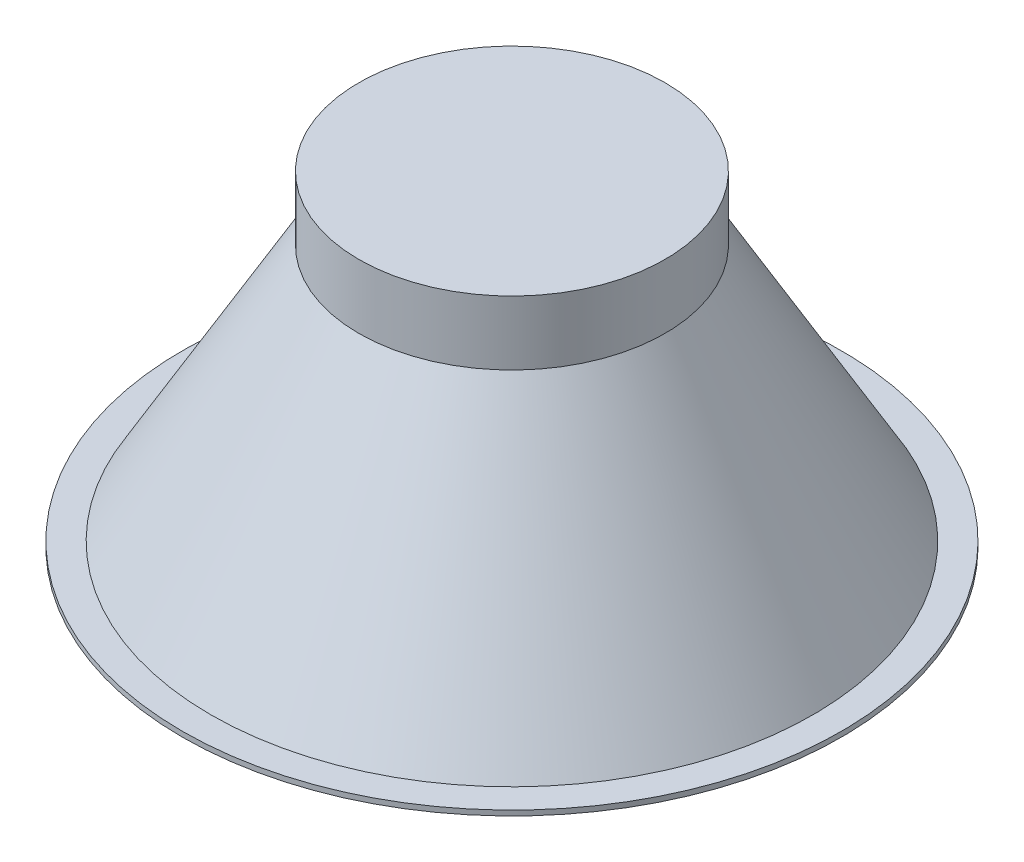
from build123d import *

# Parameters (mm, degrees)
SKETCH1_R           = 128.5875
BOSS_EXTRUDE1_DEPTH = 2
SKETCH2_R           = 117.475
BOSS_EXTRUDE2_DEPTH = 100
BOSS_EXTRUDE2_TAPER = 30
SKETCH6_R           = 59.739973081
BOSS_EXTRUDE3_DEPTH = 25


with BuildPart() as part:
    # Sketch1 → Boss-Extrude1 (new body)
    with BuildSketch(Plane(origin=(0, 0, 0), x_dir=(1, 0, 0), z_dir=(0, 1, 0))):
        with Locations(Location((0, 0, 0), (0, 0, 270))):
            Circle(SKETCH1_R)
    extrude(amount=BOSS_EXTRUDE1_DEPTH)

    # Sketch2 → Boss-Extrude2 (add)
    with BuildSketch(Plane(origin=(0, 2, 0), x_dir=(1, 0, 0), z_dir=(0, 1, 0))):
        Circle(SKETCH2_R)
    extrude(amount=BOSS_EXTRUDE2_DEPTH, taper=BOSS_EXTRUDE2_TAPER)

    # Sketch6 → Boss-Extrude3 (add)
    with BuildSketch(Plane(origin=(0, 102, 0), x_dir=(1, 0, 0), z_dir=(0, 1, 0))):
        with Locations(Location((0, 0, 0), (0, 0, 270))):
            Circle(SKETCH6_R)
    extrude(amount=BOSS_EXTRUDE3_DEPTH)


solid = part.part
